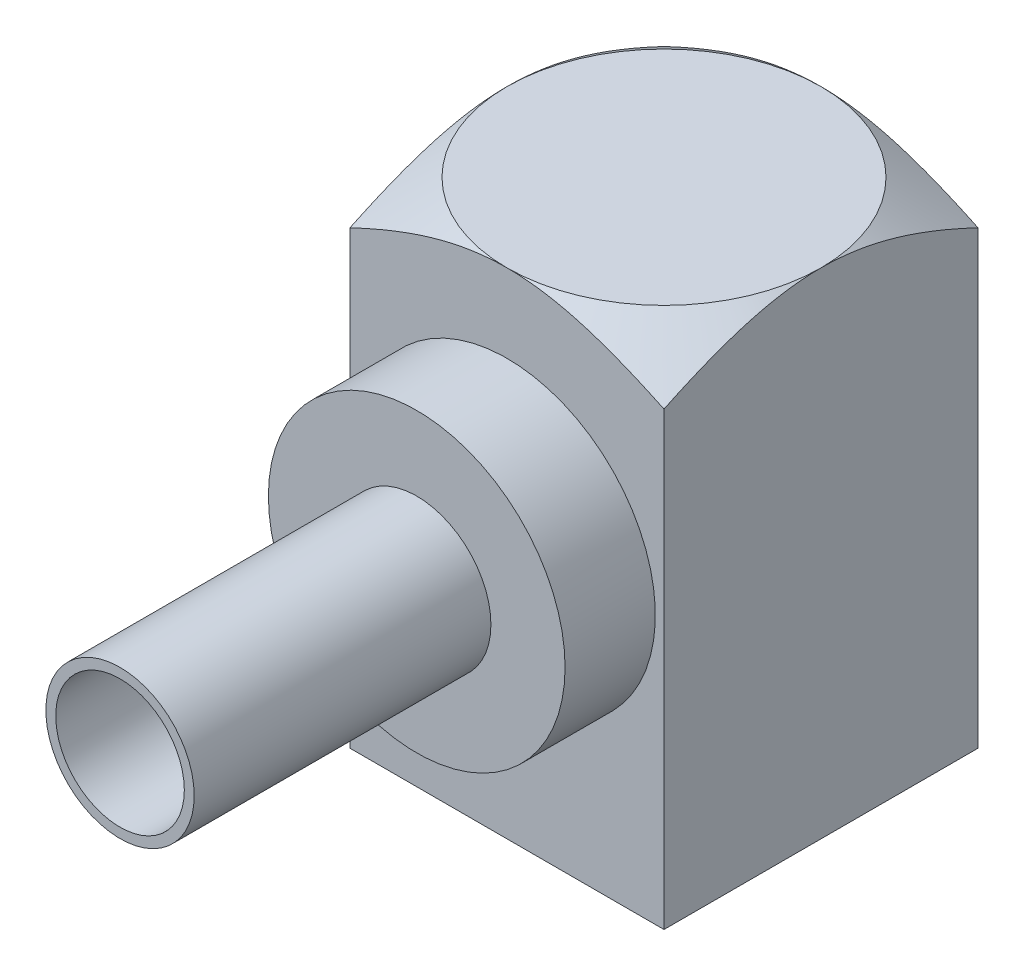
from build123d import *

# Parameters (mm, degrees)
SKETCH_2_W      = 6.35
SKETCH_2_H      = 6.35
EXTRUDE_1_DEPTH = 10
SKETCH_6_R      = 3
EXTRUDE_2_DEPTH = 5
SKETCH_7_R      = 1.5
SKETCH_7_R_2    = 1.3
EXTRUDE_3_DEPTH = 6


with BuildPart() as part:
    # 草图2 → 凸台-拉伸1 (new body)
    with BuildSketch(Plane(origin=(0, 0, 0), x_dir=(1, 0, 0), z_dir=(0, 1, 0))):
        Rectangle(SKETCH_2_W, SKETCH_2_H)
    extrude(amount=EXTRUDE_1_DEPTH)

    # 草图5 → 切除-旋转1 (revolve, cut)
    with BuildSketch(Plane.XY):
        Polygon((3.175, 10), (5.248872861, 14.588450108), (5.248872861, 8.60417478), align=None)
    revolve(axis=Axis((0, 15.427678148, 0), (0, -1, 0)), mode=Mode.SUBTRACT)

    # 草图6 → 凸台-拉伸2 (add)
    with BuildSketch(Plane.XY):
        with Locations(Location((0, 5.416720089, 0), (0, 0, 180))):
            Circle(SKETCH_6_R)
    extrude(amount=EXTRUDE_2_DEPTH)

    # 草图7 → 凸台-拉伸3 (add)
    with BuildSketch(Plane.XY.offset(5)):
        with Locations((0, 5.416720089)):
            Circle(SKETCH_7_R)
        with Locations((0, 5.416720089)):
            Circle(SKETCH_7_R_2, mode=Mode.SUBTRACT)
    extrude(amount=EXTRUDE_3_DEPTH)


solid = part.part
